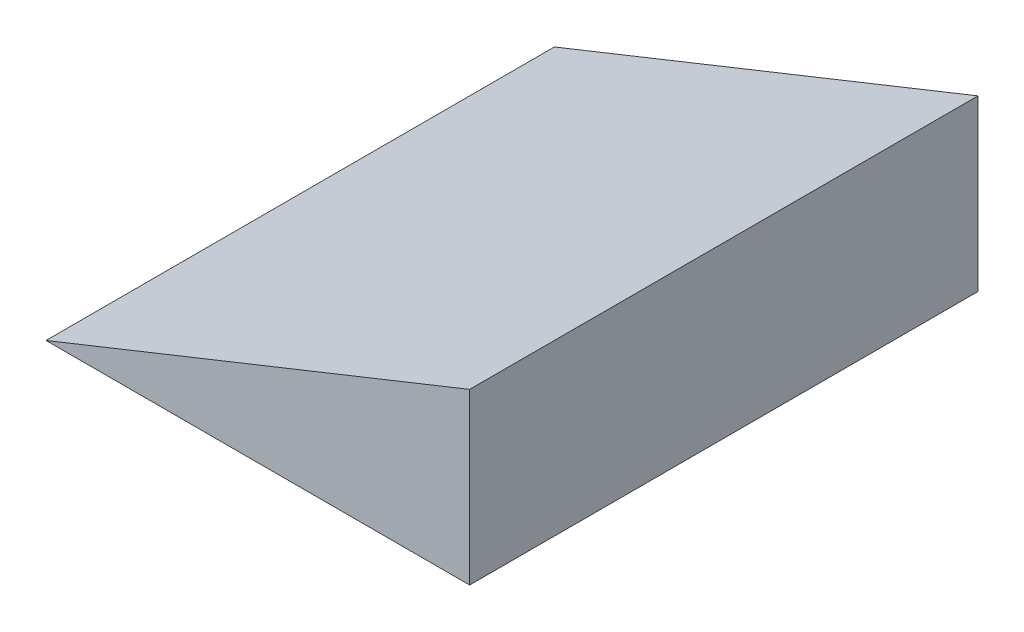
from build123d import *

# Parameters (mm, degrees)
SKETCH_1_W          = 250
SKETCH_1_H          = 300
EXTRUDE_1_DEPTH     = 100
CUT_EXTRUDE_1_REACH = 350.717


with BuildPart() as part:
    # 草图1 → 凸台-拉伸1 (new body)
    with BuildSketch(Plane(origin=(0, 0, 0), x_dir=(1, 0, 0), z_dir=(0, 1, 0))):
        with Locations((21.980772074, -24.550304641)):
            Rectangle(SKETCH_1_W, SKETCH_1_H)
    extrude(amount=EXTRUDE_1_DEPTH)

    # 草图2 → 切除-拉伸1 (cut, up to next)
    with BuildSketch(Plane.XY.offset(174.550304641), mode=Mode.PRIVATE) as cut_extrude_1_sk1:
        Polygon((-103.019227926, 0), (146.980772074, 100), (-103.019227926, 100), align=None)
    cut_extrude_1_tool1 = extrude(cut_extrude_1_sk1.sketch, amount=-CUT_EXTRUDE_1_REACH, mode=Mode.PRIVATE) & part.part
    add(cut_extrude_1_tool1.solids().sort_by_distance((-19.685895, 66.666667, 174.550305))[0], mode=Mode.SUBTRACT)


solid = part.part
